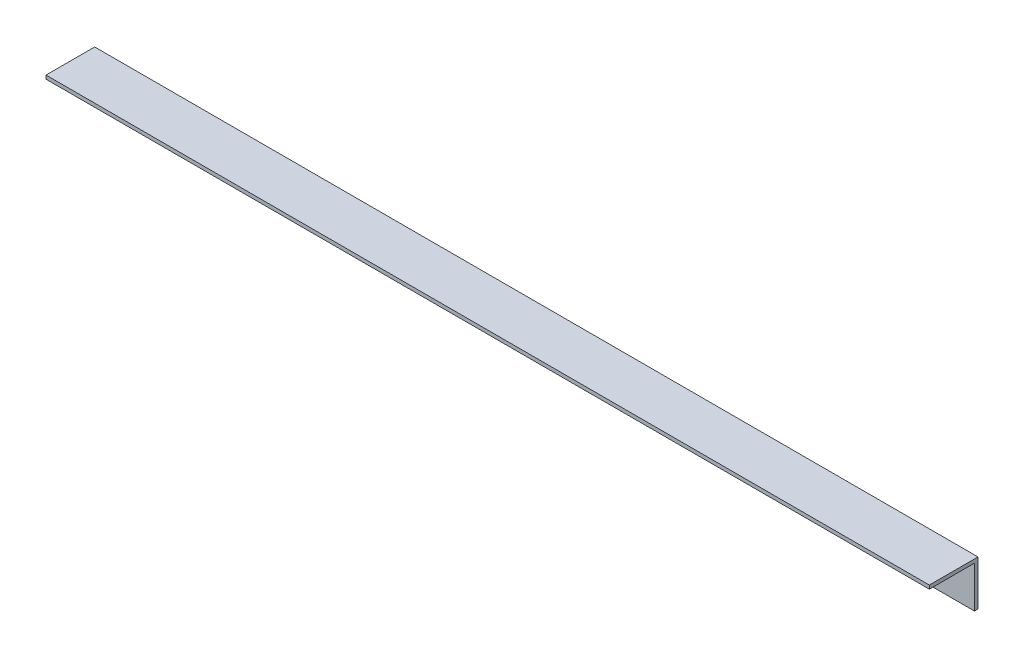
from build123d import *

# Parameters (mm, degrees)
SKETCH_1_W        = 1960
SKETCH_1_H        = 100
EXTRUDE_665_DEPTH = 8
SKETCH_2_W        = 1960
SKETCH_2_H        = 8
EXTRUDE_1_DEPTH   = 100


with BuildPart() as part:
    # 草图1 → Extrude 665 (new body)
    with BuildSketch(Plane.XY):
        with Locations((0, 44.512115183)):
            Rectangle(SKETCH_1_W, SKETCH_1_H)
    extrude(amount=EXTRUDE_665_DEPTH)

    # 草图2 → 凸台-拉伸1 (add)
    with BuildSketch(Plane.XY.offset(8)):
        with Locations((0, 90.512115183)):
            Rectangle(SKETCH_2_W, SKETCH_2_H)
    extrude(amount=EXTRUDE_1_DEPTH)


solid = part.part
